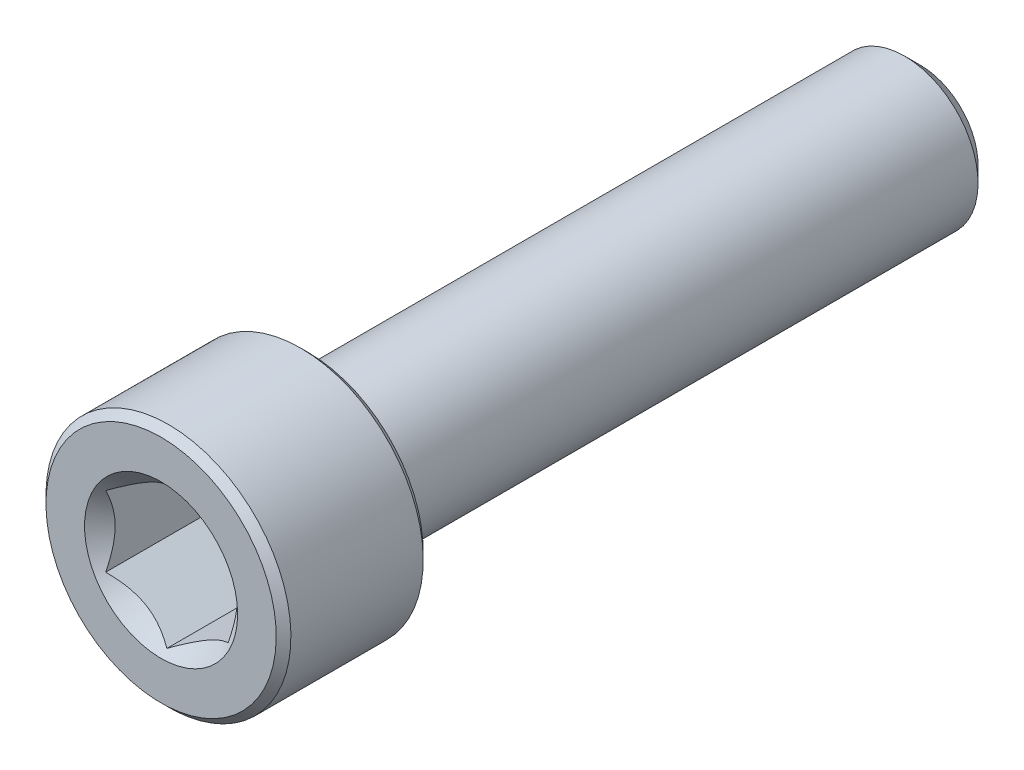
from build123d import *

# Parameters (mm, degrees)
CUT_EXTRUDE1_DEPTH = 5
SKETCH4_R          = 3.125
CUT_EXTRUDE2_DEPTH = 3
CUT_EXTRUDE2_DRAFT = -45


with BuildPart() as part:
    # Sketch2 → Revolve1 (revolve)
    with BuildSketch(Plane(origin=(0, 0, 0), x_dir=(0, 0, -1), z_dir=(1, 0, 0))):
        with BuildLine():
            Line((-15.5, 0), (-15.5, 4.7))
            Line((-15.5, 4.7), (-15.2, 5))
            Line((-15.2, 5), (-9.8, 5))
            Line((-9.8, 5), (-9.5, 4.7))
            Line((-9.5, 4.7), (-9.5, 3.3))
            ThreePointArc((-9.5, 3.3), (-9.412132034, 3.087867966), (-9.2, 3))
            Line((-9.2, 3), (14.850480947, 3))
            Line((14.850480947, 3), (15.5, 2.350480947))
            Line((15.5, 2.350480947), (15.5, 0))
            Line((15.5, 0), (-15.5, 0))
        make_face()
    revolve(axis=Axis((0, 0, -15.5), (0, 0, 1)))

    # Sketch3 → Cut-Extrude1 (cut)
    with BuildSketch(Plane.XY.offset(15.5)):
        Polygon((2.5, -1.443375673), (2.5, 1.443375673), (0, 2.886751346), (-2.5, 1.443375673), (-2.5, -1.443375673), (0, -2.886751346), align=None)
    extrude(amount=-CUT_EXTRUDE1_DEPTH, mode=Mode.SUBTRACT)


with BuildPart() as cut_extrude2_tool:
    # Sketch4 → Cut-Extrude2 (with draft: the straight prism first)
    with BuildSketch(Plane.XY.offset(15.5)):
        Circle(SKETCH4_R)
    extrude(amount=-CUT_EXTRUDE2_DEPTH)
    # Cut-Extrude2: the draft: its side faces are tilted about the plane it starts from
    cut_extrude2_sides = [cut_extrude2_tool.faces().sort_by_distance(p)[0] for p in [
        (-3.125, 0, 14),
    ]]
    draft(cut_extrude2_sides, Plane.XY.offset(15.5), CUT_EXTRUDE2_DRAFT)


with BuildPart() as part_1:
    add(part.part)

    # Cut-Extrude2: cut by cut_extrude2_tool
    add(cut_extrude2_tool.part, mode=Mode.SUBTRACT)


solid = part_1.part
